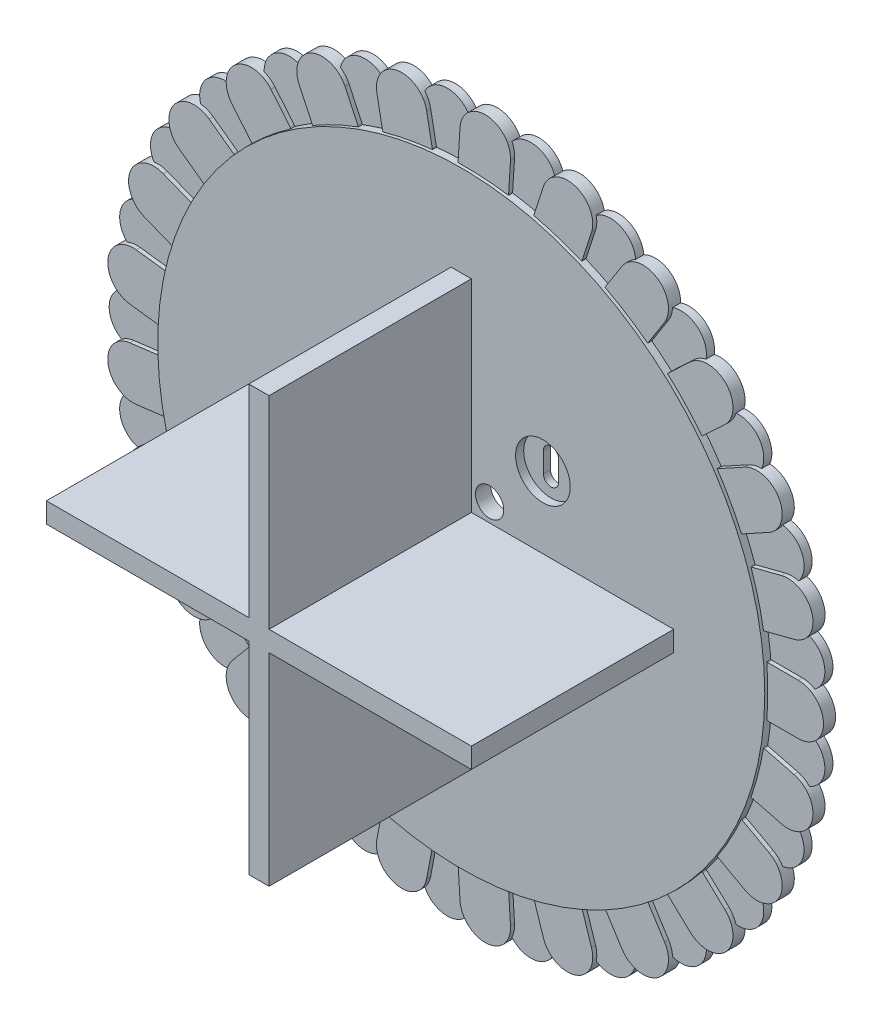
from build123d import *

# Parameters (mm, degrees)
SCHIZZO1_R                   = 30
ESTRUSIONE_ESTRUSIONE1_DEPTH = 1.5
ESTRUSIONE_ESTRUSIONE2_DEPTH = 20
ESTRUSIONE_ESTRUSIONE3_DEPTH = 0.8
ESTRUSIONE_ESTRUSIONE4_DEPTH = 1.2
SCHIZZO6_R                   = 1.4
TAGLIO_ESTRUSIONE3_DEPTH     = 54.998896887
SCHIZZO7_R                   = 2.7
TAGLIO_ESTRUSIONE4_DEPTH     = 0.8
TAGLIO_ESTRUSIONE5_DEPTH     = 54.998896887


with BuildPart() as part:
    # Schizzo1 → Estrusione-Estrusione1 (new body)
    with BuildSketch(Plane.XY):
        Circle(SCHIZZO1_R)
    extrude(amount=ESTRUSIONE_ESTRUSIONE1_DEPTH)

    # Schizzo2 → Estrusione-Estrusione2 (add)
    with BuildSketch(Plane.XY.offset(1.5)):
        Polygon((-1, 1), (-1, 21), (1, 21), (1, 1), (21, 1), (21, -1), (1, -1), (1, -21), (-1, -21), (-1, -1), (-21, -1), (-21, 1), align=None)
    extrude(amount=ESTRUSIONE_ESTRUSIONE2_DEPTH)

    # Schizzo5 → Estrusione-Estrusione3 (add)
    with BuildSketch(Plane(origin=(0, 0, 0), x_dir=(-1, 0, 0), z_dir=(0, 0, -1))):
        with BuildLine():
            ThreePointArc((-29.895833333, -2.497828918), (-29.947905355, -2.499457171), (-30, -2.5))
            Line((-30, -2.5), (-33, -2.5))
            ThreePointArc((-33, -2.5), (-33.655910107, -2.41242242), (-34.265865799, -2.155825545))
            ThreePointArc((-34.265865799, -2.155825545), (-35.220071897, -4.449329792), (-33.725472626, -6.433477978))
            ThreePointArc((-33.725472626, -6.433477978), (-33.198492862, -6.033252754), (-32.584969035, -5.785308374))
            Line((-32.584969035, -5.785308374), (-29.679219552, -5.039238712))
            ThreePointArc((-29.679219552, -5.039238712), (-29.62862656, -5.026809076), (-29.577785546, -5.015436389))
            ThreePointArc((-29.577785546, -5.015436389), (-29.763441039, -3.759997007), (-29.895833333, -2.497828918))
        make_face()
        with BuildLine():
            ThreePointArc((-33.725472626, 6.433477978), (-35.220071897, 4.449329792), (-34.265865799, 2.155825545))
            ThreePointArc((-34.265865799, 2.155825545), (-33.655910107, 2.41242242), (-33, 2.5))
            Line((-33, 2.5), (-30, 2.5))
            ThreePointArc((-30, 2.5), (-29.947905355, 2.499457171), (-29.895833333, 2.497828918))
            ThreePointArc((-29.895833333, 2.497828918), (-29.763441039, 3.759997007), (-29.577785546, 5.015436389))
            ThreePointArc((-29.577785546, 5.015436389), (-29.62862656, 5.026809076), (-29.679219552, 5.039238712))
            Line((-29.679219552, 5.039238712), (-32.584969035, 5.785308374))
            ThreePointArc((-32.584969035, 5.785308374), (-33.198492862, 6.033252754), (-33.725472626, 6.433477978))
        make_face()
        with BuildLine():
            ThreePointArc((-31.341519599, -10.628224179), (-31.998602743, -10.70651622), (-32.653208603, -10.60967062))
            ThreePointArc((-32.653208603, -10.60967062), (-33.007065249, -13.06842162), (-31.065983974, -14.618542419))
            ThreePointArc((-31.065983974, -14.618542419), (-30.655092214, -14.099836468), (-30.122504627, -13.707104545))
            Line((-30.122504627, -13.707104545), (-27.493584587, -12.261843523))
            ThreePointArc((-27.493584587, -12.261843523), (-27.447672191, -12.237222421), (-27.401256714, -12.213563382))
            ThreePointArc((-27.401256714, -12.213563382), (-27.893294577, -11.043736581), (-28.335415963, -9.854146448))
            ThreePointArc((-28.335415963, -9.854146448), (-28.385447116, -9.868673331), (-28.435770116, -9.882154518))
            Line((-28.435770116, -9.882154518), (-31.341519599, -10.628224179))
        make_face()
        with BuildLine():
            ThreePointArc((-31.065983974, 14.618542419), (-33.007065249, 13.06842162), (-32.653208603, 10.60967062))
            ThreePointArc((-32.653208603, 10.60967062), (-31.998602743, 10.70651622), (-31.341519599, 10.628224179))
            Line((-31.341519599, 10.628224179), (-28.435770116, 9.882154518))
            ThreePointArc((-28.435770116, 9.882154518), (-28.385447116, 9.868673331), (-28.335415963, 9.854146448))
            ThreePointArc((-28.335415963, 9.854146448), (-27.893294577, 11.043736581), (-27.401256714, 12.213563382))
            ThreePointArc((-27.401256714, 12.213563382), (-27.447672191, 12.237222421), (-27.493584587, 12.261843523))
            Line((-27.493584587, 12.261843523), (-30.122504627, 13.707104545))
            ThreePointArc((-30.122504627, 13.707104545), (-30.655092214, 14.099836468), (-31.065983974, 14.618542419))
        make_face()
        with BuildLine():
            ThreePointArc((-27.713736256, -18.088637945), (-28.330705486, -18.327880231), (-28.98883022, -18.396871071))
            ThreePointArc((-28.98883022, -18.396871071), (-28.7201033, -20.866376456), (-26.454505296, -21.885070076))
            ThreePointArc((-26.454505296, -21.885070076), (-26.185519381, -21.280475601), (-25.76733247, -20.767632927))
            Line((-25.76733247, -20.767632927), (-23.580426587, -18.713991609))
            ThreePointArc((-23.580426587, -18.713991609), (-23.542079634, -18.678726077), (-23.503006148, -18.644267269))
            ThreePointArc((-23.503006148, -18.644267269), (-24.270509831, -17.633557569), (-24.994580197, -16.591291715))
            ThreePointArc((-24.994580197, -16.591291715), (-25.039426841, -16.617804452), (-25.084816216, -16.643376923))
            Line((-25.084816216, -16.643376923), (-27.713736256, -18.088637945))
        make_face()
        with BuildLine():
            ThreePointArc((-26.454505296, 21.885070076), (-28.7201033, 20.866376456), (-28.98883022, 18.396871071))
            ThreePointArc((-28.98883022, 18.396871071), (-28.330705486, 18.327880231), (-27.713736256, 18.088637945))
            Line((-27.713736256, 18.088637945), (-25.084816216, 16.643376923))
            ThreePointArc((-25.084816216, 16.643376923), (-25.039426841, 16.617804452), (-24.994580197, 16.591291715))
            ThreePointArc((-24.994580197, 16.591291715), (-24.270509831, 17.633557569), (-23.503006148, 18.644267269))
            ThreePointArc((-23.503006148, 18.644267269), (-23.542079634, 18.678726077), (-23.580426587, 18.713991609))
            Line((-23.580426587, 18.713991609), (-25.76733247, 20.767632927))
            ThreePointArc((-25.76733247, 20.767632927), (-26.185519381, 21.280475601), (-26.454505296, 21.885070076))
        make_face()
        with BuildLine():
            ThreePointArc((-22.34459694, -24.412476064), (-22.88268581, -24.797636121), (-23.502977021, -25.028128453))
            ThreePointArc((-23.502977021, -25.028128453), (-22.628551636, -27.353220119), (-20.180792758, -27.776478293))
            ThreePointArc((-20.180792758, -27.776478293), (-20.070614062, -27.123984189), (-19.793104048, -26.523254554))
            Line((-19.793104048, -26.523254554), (-18.185623663, -23.990270778))
            ThreePointArc((-18.185623663, -23.990270778), (-18.157251631, -23.946576677), (-18.127975267, -23.903483276))
            ThreePointArc((-18.127975267, -23.903483276), (-19.122719692, -23.115397283), (-20.083243033, -22.285945106))
            ThreePointArc((-20.083243033, -22.285945106), (-20.120087288, -22.322777803), (-20.157691058, -22.358834746))
            Line((-20.157691058, -22.358834746), (-22.34459694, -24.412476064))
        make_face()
        with BuildLine():
            ThreePointArc((-20.180792758, 27.776478293), (-22.628551636, 27.353220119), (-23.502977021, 25.028128453))
            ThreePointArc((-23.502977021, 25.028128453), (-22.88268581, 24.797636121), (-22.34459694, 24.412476064))
            Line((-22.34459694, 24.412476064), (-20.157691058, 22.358834746))
            ThreePointArc((-20.157691058, 22.358834746), (-20.120087288, 22.322777803), (-20.083243033, 22.285945106))
            ThreePointArc((-20.083243033, 22.285945106), (-19.122719692, 23.115397283), (-18.127975267, 23.903483276))
            ThreePointArc((-18.127975267, 23.903483276), (-18.157251631, 23.946576677), (-18.185623663, 23.990270778))
            Line((-18.185623663, 23.990270778), (-19.793104048, 26.523254554))
            ThreePointArc((-19.793104048, 26.523254554), (-20.070614062, 27.123984189), (-20.180792758, 27.776478293))
        make_face()
        with BuildLine():
            ThreePointArc((-15.571464421, -29.202388529), (-15.996862828, -29.709265335), (-16.540345338, -30.086776478))
            ThreePointArc((-16.540345338, -30.086776478), (-15.115164851, -32.121360363), (-12.639046791, -31.922588224))
            ThreePointArc((-12.639046791, -31.922588224), (-12.694598247, -31.263193094), (-12.575202105, -30.612322552))
            Line((-12.575202105, -30.612322552), (-11.648151122, -27.759153003))
            ThreePointArc((-11.648151122, -27.759153003), (-11.63153673, -27.709775795), (-11.61389703, -27.660755517))
            ThreePointArc((-11.61389703, -27.660755517), (-12.773378747, -27.144811574), (-13.910001849, -26.580290603))
            ThreePointArc((-13.910001849, -26.580290603), (-13.936528655, -26.625128927), (-13.963984036, -26.669404753))
            Line((-13.963984036, -26.669404753), (-15.571464421, -29.202388529))
        make_face()
        with BuildLine():
            ThreePointArc((-12.639046791, 31.922588224), (-15.115164851, 32.121360363), (-16.540345338, 30.086776478))
            ThreePointArc((-16.540345338, 30.086776478), (-15.996862828, 29.709265335), (-15.571464421, 29.202388529))
            Line((-15.571464421, 29.202388529), (-13.963984036, 26.669404753))
            ThreePointArc((-13.963984036, 26.669404753), (-13.936528655, 26.625128927), (-13.910001849, 26.580290603))
            ThreePointArc((-13.910001849, 26.580290603), (-12.773378747, 27.144811574), (-11.61389703, 27.660755517))
            ThreePointArc((-11.61389703, 27.660755517), (-11.63153673, 27.709775795), (-11.648151122, 27.759153003))
            Line((-11.648151122, 27.759153003), (-12.575202105, 30.612322552))
            ThreePointArc((-12.575202105, 30.612322552), (-12.694598247, 31.263193094), (-12.639046791, 31.922588224))
        make_face()
        with BuildLine():
            ThreePointArc((-7.819919524, -32.157407524), (-8.105898122, -32.754152145), (-8.538422926, -33.254961685))
            ThreePointArc((-8.538422926, -33.254961685), (-6.652036668, -34.871197401), (-4.303143031, -34.062884534))
            ThreePointArc((-4.303143031, -34.062884534), (-4.520934136, -33.4380206), (-4.567153966, -32.777905739))
            Line((-4.567153966, -32.777905739), (-4.378782407, -29.783825554))
            ThreePointArc((-4.378782407, -29.783825554), (-4.374969599, -29.731867791), (-4.37007493, -29.68000076))
            ThreePointArc((-4.37007493, -29.68000076), (-5.621439438, -29.468617522), (-6.862744092, -29.204498687))
            ThreePointArc((-6.862744092, -29.204498687), (-6.877286671, -29.25452528), (-6.892868541, -29.304237975))
            Line((-6.892868541, -29.304237975), (-7.819919524, -32.157407524))
        make_face()
        with BuildLine():
            ThreePointArc((-4.303143031, 34.062884534), (-6.652036668, 34.871197401), (-8.538422926, 33.254961685))
            ThreePointArc((-8.538422926, 33.254961685), (-8.105898122, 32.754152145), (-7.819919524, 32.157407524))
            Line((-7.819919524, 32.157407524), (-6.892868541, 29.304237975))
            ThreePointArc((-6.892868541, 29.304237975), (-6.877286671, 29.25452528), (-6.862744092, 29.204498687))
            ThreePointArc((-6.862744092, 29.204498687), (-5.621439438, 29.468617522), (-4.37007493, 29.68000076))
            ThreePointArc((-4.37007493, 29.68000076), (-4.374969599, 29.731867791), (-4.378782407, 29.783825554))
            Line((-4.378782407, 29.783825554), (-4.567153966, 32.777905739))
            ThreePointArc((-4.567153966, 32.777905739), (-4.520934136, 33.4380206), (-4.303143031, 34.062884534))
        make_face()
        with BuildLine():
            ThreePointArc((0.422979677, -33.091858337), (0.294389974, -33.740975114), (0, -34.333615346))
            ThreePointArc((0, -34.333615346), (2.229063443, -35.429948859), (4.303143031, -34.062884534))
            ThreePointArc((4.303143031, -34.062884534), (3.936796893, -33.511814294), (3.727865255, -32.883932561))
            Line((3.727865255, -32.883932561), (3.165721311, -29.937070808))
            ThreePointArc((3.165721311, -29.937070808), (3.156492962, -29.885797187), (3.14833505, -29.8343424))
            ThreePointArc((3.14833505, -29.8343424), (1.883715586, -29.940801853), (0.615725117, -29.993680711))
            ThreePointArc((0.615725117, -29.993680711), (0.614080527, -30.045752219), (0.611351235, -30.097778152))
            Line((0.611351235, -30.097778152), (0.422979677, -33.091858337))
        make_face()
        with BuildLine():
            ThreePointArc((4.303143031, 34.062884534), (2.229063443, 35.429948859), (0, 34.333615346))
            ThreePointArc((0, 34.333615346), (0.294389974, 33.740975114), (0.422979677, 33.091858337))
            Line((0.422979677, 33.091858337), (0.611351235, 30.097778152))
            ThreePointArc((0.611351235, 30.097778152), (0.614080527, 30.045752219), (0.615725117, 29.993680711))
            ThreePointArc((0.615725117, 29.993680711), (1.883715586, 29.940801853), (3.14833505, 29.8343424))
            ThreePointArc((3.14833505, 29.8343424), (3.156492962, 29.885797187), (3.165721311, 29.937070808))
            Line((3.165721311, 29.937070808), (3.727865255, 32.883932561))
            ThreePointArc((3.727865255, 32.883932561), (3.936796893, 33.511814294), (4.303143031, 34.062884534))
        make_face()
        with BuildLine():
            ThreePointArc((8.639301508, -31.947025988), (8.676180466, -32.607728526), (8.538422926, -33.254961685))
            ThreePointArc((8.538422926, -33.254961685), (10.9701033, -33.762506328), (12.639046791, -31.922588224))
            ThreePointArc((12.639046791, -31.922588224), (12.147164495, -31.479937449), (11.78864899, -30.92374096))
            Line((11.78864899, -30.92374096), (10.511311116, -28.209259803))
            ThreePointArc((10.511311116, -28.209259803), (10.489621462, -28.161892034), (10.46892356, -28.114082583))
            ThreePointArc((10.46892356, -28.114082583), (9.270509831, -28.531695489), (8.055506052, -28.898249467))
            ThreePointArc((8.055506052, -28.898249467), (8.066862787, -28.949094046), (8.077157564, -29.000164235))
            Line((8.077157564, -29.000164235), (8.639301508, -31.947025988))
        make_face()
        with BuildLine():
            ThreePointArc((12.639046791, 31.922588224), (10.9701033, 33.762506328), (8.538422926, 33.254961685))
            ThreePointArc((8.538422926, 33.254961685), (8.676180466, 32.607728526), (8.639301508, 31.947025988))
            Line((8.639301508, 31.947025988), (8.077157564, 29.000164235))
            ThreePointArc((8.077157564, 29.000164235), (8.066862787, 28.949094046), (8.055506052, 28.898249467))
            ThreePointArc((8.055506052, 28.898249467), (9.270509831, 28.531695489), (10.46892356, 28.114082583))
            ThreePointArc((10.46892356, 28.114082583), (10.489621462, 28.161892034), (10.511311116, 28.209259803))
            Line((10.511311116, 28.209259803), (11.78864899, 30.92374096))
            ThreePointArc((11.78864899, 30.92374096), (12.147164495, 31.479937449), (12.639046791, 31.922588224))
        make_face()
        with BuildLine():
            ThreePointArc((16.312784253, -28.794844502), (16.51281463, -29.425618432), (16.540345338, -30.086776478))
            ThreePointArc((16.540345338, -30.086776478), (19.021851222, -29.973641355), (20.180792758, -27.776478293))
            ThreePointArc((20.180792758, -27.776478293), (19.594281078, -27.470060359), (19.108708555, -27.020496986))
            Line((19.108708555, -27.020496986), (17.196436586, -24.708957258))
            ThreePointArc((17.196436586, -24.708957258), (17.163648466, -24.668471632), (17.1317111, -24.627311562))
            ThreePointArc((17.1317111, -24.627311562), (16.074803849, -25.329837765), (14.989129915, -25.987034929))
            ThreePointArc((14.989129915, -25.987034929), (15.012774391, -26.033457827), (15.035446378, -26.080363345))
            Line((15.035446378, -26.080363345), (16.312784253, -28.794844502))
        make_face()
        with BuildLine():
            ThreePointArc((20.180792758, 27.776478293), (19.021851222, 29.973641355), (16.540345338, 30.086776478))
            ThreePointArc((16.540345338, 30.086776478), (16.51281463, 29.425618432), (16.312784253, 28.794844502))
            Line((16.312784253, 28.794844502), (15.035446378, 26.080363345))
            ThreePointArc((15.035446378, 26.080363345), (15.012774391, 26.033457827), (14.989129915, 25.987034929))
            ThreePointArc((14.989129915, 25.987034929), (16.074803849, 25.329837765), (17.1317111, 24.627311562))
            ThreePointArc((17.1317111, 24.627311562), (17.163648466, 24.668471632), (17.196436586, 24.708957258))
            Line((17.196436586, 24.708957258), (19.108708555, 27.020496986))
            ThreePointArc((19.108708555, 27.020496986), (19.594281078, 27.470060359), (20.180792758, 27.776478293))
        make_face()
        with BuildLine():
            ThreePointArc((22.961274769, -23.833377037), (23.311887921, -24.394588512), (23.502977021, -25.028128453))
            ThreePointArc((23.502977021, -25.028128453), (25.878386273, -24.30142226), (26.454505296, -21.885070076))
            ThreePointArc((26.454505296, -21.885070076), (25.810216917, -21.734138349), (25.228097684, -21.419455812))
            Line((25.228097684, -21.419455812), (22.801046701, -19.656100055))
            ThreePointArc((22.801046701, -19.656100055), (22.759220315, -19.625040433), (22.718050227, -19.593115982))
            ThreePointArc((22.718050227, -19.593115982), (21.869058823, -20.536413178), (20.98093162, -21.442959412))
            ThreePointArc((20.98093162, -21.442959412), (21.015378166, -21.482043708), (21.049002799, -21.521837309))
            Line((21.049002799, -21.521837309), (22.961274769, -23.833377037))
        make_face()
        with BuildLine():
            ThreePointArc((26.454505296, 21.885070076), (25.878386273, 24.30142226), (23.502977021, 25.028128453))
            ThreePointArc((23.502977021, 25.028128453), (23.311887921, 24.394588512), (22.961274769, 23.833377037))
            Line((22.961274769, 23.833377037), (21.049002799, 21.521837309))
            ThreePointArc((21.049002799, 21.521837309), (21.015378166, 21.482043708), (20.98093162, 21.442959412))
            ThreePointArc((20.98093162, 21.442959412), (21.869058823, 20.536413178), (22.718050227, 19.593115982))
            ThreePointArc((22.718050227, 19.593115982), (22.759220315, 19.625040433), (22.801046701, 19.656100055))
            Line((22.801046701, 19.656100055), (25.228097684, 21.419455812))
            ThreePointArc((25.228097684, 21.419455812), (25.810216917, 21.734138349), (26.454505296, 21.885070076))
        make_face()
        with BuildLine():
            ThreePointArc((28.167023945, -17.37437084), (28.646189559, -17.830756878), (28.98883022, -18.396871071))
            ThreePointArc((28.98883022, -18.396871071), (31.108887142, -17.102255431), (31.065983974, -14.618542419))
            ThreePointArc((31.065983974, -14.618542419), (30.404401905, -14.632580493), (29.762312653, -14.472551453))
            Line((29.762312653, -14.472551453), (26.972983195, -13.368177795))
            ThreePointArc((26.972983195, -13.368177795), (26.924746648, -13.348495768), (26.876930706, -13.327812867))
            ThreePointArc((26.876930706, -13.327812867), (26.289200401, -14.452610223), (25.654424229, -15.551543894))
            ThreePointArc((25.654424229, -15.551543894), (25.697508442, -15.580833777), (25.739972962, -15.611015083))
            Line((25.739972962, -15.611015083), (28.167023945, -17.37437084))
        make_face()
        with BuildLine():
            ThreePointArc((31.065983974, 14.618542419), (31.108887142, 17.102255431), (28.98883022, 18.396871071))
            ThreePointArc((28.98883022, 18.396871071), (28.646189559, 17.830756878), (28.167023945, 17.37437084))
            Line((28.167023945, 17.37437084), (25.739972962, 15.611015083))
            ThreePointArc((25.739972962, 15.611015083), (25.697508442, 15.580833777), (25.654424229, 15.551543894))
            ThreePointArc((25.654424229, 15.551543894), (26.289200401, 14.452610223), (26.876930706, 13.327812867))
            ThreePointArc((26.876930706, 13.327812867), (26.924746648, 13.348495768), (26.972983195, 13.368177795))
            Line((26.972983195, 13.368177795), (29.762312653, 14.472551453))
            ThreePointArc((29.762312653, 14.472551453), (30.404401905, 14.632580493), (31.065983974, 14.618542419))
        make_face()
        with BuildLine():
            ThreePointArc((31.602935416, -9.823669024), (32.180545753, -10.146553214), (32.653208603, -10.60967062))
            ThreePointArc((32.653208603, -10.60967062), (34.38470222, -8.828490994), (33.725472626, -6.433477978))
            ThreePointArc((33.725472626, -6.433477978), (33.088166501, -6.611603791), (32.426452059, -6.616283461))
            Line((32.426452059, -6.616283461), (29.450107956, -6.24028376))
            ThreePointArc((29.450107956, -6.24028376), (29.398492127, -6.233216021), (29.347034783, -6.225074253))
            ThreePointArc((29.347034783, -6.225074253), (29.057494834, -7.460696615), (28.715955013, -8.682967679))
            ThreePointArc((28.715955013, -8.682967679), (28.764969754, -8.700622758), (28.813605958, -8.719295366))
            Line((28.813605958, -8.719295366), (31.602935416, -9.823669024))
        make_face()
        with BuildLine():
            ThreePointArc((33.725472626, 6.433477978), (34.38470222, 8.828490994), (32.653208603, 10.60967062))
            ThreePointArc((32.653208603, 10.60967062), (32.180545753, 10.146553214), (31.602935416, 9.823669024))
            Line((31.602935416, 9.823669024), (28.813605958, 8.719295366))
            ThreePointArc((28.813605958, 8.719295366), (28.764969754, 8.700622758), (28.715955013, 8.682967679))
            ThreePointArc((28.715955013, 8.682967679), (29.057494834, 7.460696615), (29.347034783, 6.225074253))
            ThreePointArc((29.347034783, 6.225074253), (29.398492127, 6.233216021), (29.450107956, 6.24028376))
            Line((29.450107956, 6.24028376), (32.426452059, 6.616283461))
            ThreePointArc((32.426452059, 6.616283461), (33.088166501, 6.611603791), (33.725472626, 6.433477978))
        make_face()
        with BuildLine():
            ThreePointArc((33.053118227, -1.655709954), (33.692879906, -1.824804294), (34.265865799, -2.155825545))
            ThreePointArc((34.265865799, -2.155825545), (35.5, 0), (34.265865799, 2.155825545))
            ThreePointArc((34.265865799, 2.155825545), (33.692879906, 1.824804294), (33.053118227, 1.655709954))
            Line((33.053118227, 1.655709954), (30.076774123, 1.279710254))
            ThreePointArc((30.076774123, 1.279710254), (30.025022226, 1.273719612), (29.973156733, 1.26880867))
            ThreePointArc((29.973156733, 1.26880867), (30, 0), (29.973156733, -1.26880867))
            ThreePointArc((29.973156733, -1.26880867), (30.025022226, -1.273719612), (30.076774123, -1.279710254))
            Line((30.076774123, -1.279710254), (33.053118227, -1.655709954))
        make_face()
    extrude(amount=-ESTRUSIONE_ESTRUSIONE3_DEPTH)

    # Schizzo5<3> → Estrusione-Estrusione4 (add)
    with BuildSketch(Plane(origin=(0, 0, 0), x_dir=(-1, 0, 0), z_dir=(0, 0, -1))):
        with BuildLine():
            Line((-30, -2.5), (-33, -2.5))
            ThreePointArc((-33, -2.5), (-35.5, 0), (-33, 2.5))
            Line((-33, 2.5), (-30, 2.5))
            ThreePointArc((-30, 2.5), (-27.5, 0), (-30, -2.5))
        make_face()
        with BuildLine():
            Line((-28.435770116, 9.882154518), (-31.341519599, 10.628224179))
            ThreePointArc((-31.341519599, 10.628224179), (-34.38470222, 8.828490994), (-32.584969035, 5.785308374))
            Line((-32.584969035, 5.785308374), (-29.679219552, 5.039238712))
            ThreePointArc((-29.679219552, 5.039238712), (-26.636036931, 6.838971897), (-28.435770116, 9.882154518))
        make_face()
        with BuildLine():
            Line((-25.084816216, 16.643376923), (-27.713736256, 18.088637945))
            ThreePointArc((-27.713736256, 18.088637945), (-31.108887142, 17.102255431), (-30.122504627, 13.707104545))
            Line((-30.122504627, 13.707104545), (-27.493584587, 12.261843523))
            ThreePointArc((-27.493584587, 12.261843523), (-24.098433701, 13.248226038), (-25.084816216, 16.643376923))
        make_face()
        with BuildLine():
            Line((-20.157691058, 22.358834746), (-22.34459694, 24.412476064))
            ThreePointArc((-22.34459694, 24.412476064), (-25.878386273, 24.30142226), (-25.76733247, 20.767632927))
            Line((-25.76733247, 20.767632927), (-23.580426587, 18.713991609))
            ThreePointArc((-23.580426587, 18.713991609), (-20.046637254, 18.825045413), (-20.157691058, 22.358834746))
        make_face()
        with BuildLine():
            Line((-13.963984036, 26.669404753), (-15.571464421, 29.202388529))
            ThreePointArc((-15.571464421, 29.202388529), (-19.021851222, 29.973641355), (-19.793104048, 26.523254554))
            Line((-19.793104048, 26.523254554), (-18.185623663, 23.990270778))
            ThreePointArc((-18.185623663, 23.990270778), (-14.735236862, 23.219017951), (-13.963984036, 26.669404753))
        make_face()
        with BuildLine():
            Line((-6.892868541, 29.304237975), (-7.819919524, 32.157407524))
            ThreePointArc((-7.819919524, 32.157407524), (-10.9701033, 33.762506328), (-12.575202105, 30.612322552))
            Line((-12.575202105, 30.612322552), (-11.648151122, 27.759153003))
            ThreePointArc((-11.648151122, 27.759153003), (-8.497967345, 26.154054198), (-6.892868541, 29.304237975))
        make_face()
        with BuildLine():
            Line((0.611351235, 30.097778152), (0.422979677, 33.091858337))
            ThreePointArc((0.422979677, 33.091858337), (-2.229063443, 35.429948859), (-4.567153966, 32.777905739))
            Line((-4.567153966, 32.777905739), (-4.378782407, 29.783825554))
            ThreePointArc((-4.378782407, 29.783825554), (-1.726739287, 27.445735032), (0.611351235, 30.097778152))
        make_face()
        with BuildLine():
            Line((8.077157564, 29.000164235), (8.639301508, 31.947025988))
            ThreePointArc((8.639301508, 31.947025988), (6.652036668, 34.871197401), (3.727865255, 32.883932561))
            Line((3.727865255, 32.883932561), (3.165721311, 29.937070808))
            ThreePointArc((3.165721311, 29.937070808), (5.152986151, 27.012899395), (8.077157564, 29.000164235))
        make_face()
        with BuildLine():
            Line((15.035446378, 26.080363345), (16.312784253, 28.794844502))
            ThreePointArc((16.312784253, 28.794844502), (15.115164851, 32.121360363), (11.78864899, 30.92374096))
            Line((11.78864899, 30.92374096), (10.511311116, 28.209259803))
            ThreePointArc((10.511311116, 28.209259803), (11.708930518, 24.882743943), (15.035446378, 26.080363345))
        make_face()
        with BuildLine():
            Line((21.049002799, 21.521837309), (22.961274769, 23.833377037))
            ThreePointArc((22.961274769, 23.833377037), (22.628551636, 27.353220119), (19.108708555, 27.020496986))
            Line((19.108708555, 27.020496986), (17.196436586, 24.708957258))
            ThreePointArc((17.196436586, 24.708957258), (17.529159718, 21.189114176), (21.049002799, 21.521837309))
        make_face()
        with BuildLine():
            Line((25.739972962, 15.611015083), (28.167023945, 17.37437084))
            ThreePointArc((28.167023945, 17.37437084), (28.7201033, 20.866376456), (25.228097684, 21.419455812))
            Line((25.228097684, 21.419455812), (22.801046701, 19.656100055))
            ThreePointArc((22.801046701, 19.656100055), (22.247967345, 16.164094438), (25.739972962, 15.611015083))
        make_face()
        with BuildLine():
            Line((28.813605958, 8.719295366), (31.602935416, 9.823669024))
            ThreePointArc((31.602935416, 9.823669024), (33.007065249, 13.06842162), (29.762312653, 14.472551453))
            Line((29.762312653, 14.472551453), (26.972983195, 13.368177795))
            ThreePointArc((26.972983195, 13.368177795), (25.568853362, 10.123425199), (28.813605958, 8.719295366))
        make_face()
        with BuildLine():
            Line((30.076774123, 1.279710254), (33.053118227, 1.655709954))
            ThreePointArc((33.053118227, 1.655709954), (35.220071897, 4.449329792), (32.426452059, 6.616283461))
            Line((32.426452059, 6.616283461), (29.450107956, 6.24028376))
            ThreePointArc((29.450107956, 6.24028376), (27.283154286, 3.446663923), (30.076774123, 1.279710254))
        make_face()
        with BuildLine():
            Line((29.450107956, -6.24028376), (32.426452059, -6.616283461))
            ThreePointArc((32.426452059, -6.616283461), (35.220071897, -4.449329792), (33.053118227, -1.655709954))
            Line((33.053118227, -1.655709954), (30.076774123, -1.279710254))
            ThreePointArc((30.076774123, -1.279710254), (27.283154286, -3.446663923), (29.450107956, -6.24028376))
        make_face()
        with BuildLine():
            Line((26.972983195, -13.368177795), (29.762312653, -14.472551453))
            ThreePointArc((29.762312653, -14.472551453), (33.007065249, -13.06842162), (31.602935416, -9.823669024))
            Line((31.602935416, -9.823669024), (28.813605958, -8.719295366))
            ThreePointArc((28.813605958, -8.719295366), (25.568853362, -10.123425199), (26.972983195, -13.368177795))
        make_face()
        with BuildLine():
            Line((22.801046701, -19.656100055), (25.228097684, -21.419455812))
            ThreePointArc((25.228097684, -21.419455812), (28.7201033, -20.866376456), (28.167023945, -17.37437084))
            Line((28.167023945, -17.37437084), (25.739972962, -15.611015083))
            ThreePointArc((25.739972962, -15.611015083), (22.247967345, -16.164094438), (22.801046701, -19.656100055))
        make_face()
        with BuildLine():
            Line((17.196436586, -24.708957258), (19.108708555, -27.020496986))
            ThreePointArc((19.108708555, -27.020496986), (22.628551636, -27.353220119), (22.961274769, -23.833377037))
            Line((22.961274769, -23.833377037), (21.049002799, -21.521837309))
            ThreePointArc((21.049002799, -21.521837309), (17.529159718, -21.189114176), (17.196436586, -24.708957258))
        make_face()
        with BuildLine():
            Line((10.511311116, -28.209259803), (11.78864899, -30.92374096))
            ThreePointArc((11.78864899, -30.92374096), (15.115164851, -32.121360363), (16.312784253, -28.794844502))
            Line((16.312784253, -28.794844502), (15.035446378, -26.080363345))
            ThreePointArc((15.035446378, -26.080363345), (11.708930518, -24.882743943), (10.511311116, -28.209259803))
        make_face()
        with BuildLine():
            Line((3.165721311, -29.937070808), (3.727865255, -32.883932561))
            ThreePointArc((3.727865255, -32.883932561), (6.652036668, -34.871197401), (8.639301508, -31.947025988))
            Line((8.639301508, -31.947025988), (8.077157564, -29.000164235))
            ThreePointArc((8.077157564, -29.000164235), (5.152986151, -27.012899395), (3.165721311, -29.937070808))
        make_face()
        with BuildLine():
            Line((-4.378782407, -29.783825554), (-4.567153966, -32.777905739))
            ThreePointArc((-4.567153966, -32.777905739), (-2.229063443, -35.429948859), (0.422979677, -33.091858337))
            Line((0.422979677, -33.091858337), (0.611351235, -30.097778152))
            ThreePointArc((0.611351235, -30.097778152), (-1.726739287, -27.445735032), (-4.378782407, -29.783825554))
        make_face()
        with BuildLine():
            Line((-11.648151122, -27.759153003), (-12.575202105, -30.612322552))
            ThreePointArc((-12.575202105, -30.612322552), (-10.9701033, -33.762506328), (-7.819919524, -32.157407524))
            Line((-7.819919524, -32.157407524), (-6.892868541, -29.304237975))
            ThreePointArc((-6.892868541, -29.304237975), (-8.497967345, -26.154054198), (-11.648151122, -27.759153003))
        make_face()
        with BuildLine():
            Line((-18.185623663, -23.990270778), (-19.793104048, -26.523254554))
            ThreePointArc((-19.793104048, -26.523254554), (-19.021851222, -29.973641355), (-15.571464421, -29.202388529))
            Line((-15.571464421, -29.202388529), (-13.963984036, -26.669404753))
            ThreePointArc((-13.963984036, -26.669404753), (-14.735236862, -23.219017951), (-18.185623663, -23.990270778))
        make_face()
        with BuildLine():
            Line((-23.580426587, -18.713991609), (-25.76733247, -20.767632927))
            ThreePointArc((-25.76733247, -20.767632927), (-25.878386273, -24.30142226), (-22.34459694, -24.412476064))
            Line((-22.34459694, -24.412476064), (-20.157691058, -22.358834746))
            ThreePointArc((-20.157691058, -22.358834746), (-20.046637254, -18.825045413), (-23.580426587, -18.713991609))
        make_face()
        with BuildLine():
            Line((-27.493584587, -12.261843523), (-30.122504627, -13.707104545))
            ThreePointArc((-30.122504627, -13.707104545), (-31.108887142, -17.102255431), (-27.713736256, -18.088637945))
            Line((-27.713736256, -18.088637945), (-25.084816216, -16.643376923))
            ThreePointArc((-25.084816216, -16.643376923), (-24.098433701, -13.248226038), (-27.493584587, -12.261843523))
        make_face()
        with BuildLine():
            Line((-29.679219552, -5.039238712), (-32.584969035, -5.785308374))
            ThreePointArc((-32.584969035, -5.785308374), (-34.38470222, -8.828490994), (-31.341519599, -10.628224179))
            Line((-31.341519599, -10.628224179), (-28.435770116, -9.882154518))
            ThreePointArc((-28.435770116, -9.882154518), (-26.636036931, -6.838971897), (-29.679219552, -5.039238712))
        make_face()
    extrude(amount=-ESTRUSIONE_ESTRUSIONE4_DEPTH)

    # Schizzo6 → Taglio-Estrusione3 (cut, through all)
    with BuildSketch(Plane.XY.offset(1.5)):
        with Locations((-2.8, 2.8)):
            Circle(SCHIZZO6_R)
        with Locations((-2.8, -2.8)):
            Circle(SCHIZZO6_R)
        with Locations((2.8, -2.8)):
            Circle(SCHIZZO6_R)
        with Locations((2.8, 2.8)):
            Circle(SCHIZZO6_R)
    extrude(amount=-TAGLIO_ESTRUSIONE3_DEPTH, mode=Mode.SUBTRACT)

    # Schizzo7 → Taglio-Estrusione4 (cut)
    with BuildSketch(Plane.XY.offset(1.5)):
        with Locations((-8.071067812, 8.071067812)):
            Circle(SCHIZZO7_R)
        with Locations((-8.071067812, -8.071067812)):
            Circle(SCHIZZO7_R)
        with Locations((8.071067812, -8.071067812)):
            Circle(SCHIZZO7_R)
        with Locations((8.071067812, 8.071067812)):
            Circle(SCHIZZO7_R)
    extrude(amount=-TAGLIO_ESTRUSIONE4_DEPTH, mode=Mode.SUBTRACT)

    # Schizzo3 → Taglio-Estrusione5 (cut, through all)
    with BuildSketch(Plane.XY.offset(1.5)):
        with BuildLine():
            Line((-7.321067812, 9.071067812), (-7.321067812, 7.071067812))
            ThreePointArc((-7.321067812, 7.071067812), (-8.071067812, 6.321067812), (-8.821067812, 7.071067812))
            Line((-8.821067812, 7.071067812), (-8.821067812, 9.071067812))
            ThreePointArc((-8.821067812, 9.071067812), (-8.071067812, 9.821067812), (-7.321067812, 9.071067812))
        make_face()
        with BuildLine():
            Line((-7.321067812, -9.071067812), (-7.321067812, -7.071067812))
            ThreePointArc((-7.321067812, -7.071067812), (-8.071067812, -6.321067812), (-8.821067812, -7.071067812))
            Line((-8.821067812, -7.071067812), (-8.821067812, -9.071067812))
            ThreePointArc((-8.821067812, -9.071067812), (-8.071067812, -9.821067812), (-7.321067812, -9.071067812))
        make_face()
        with BuildLine():
            Line((7.321067812, -9.071067812), (7.321067812, -7.071067812))
            ThreePointArc((7.321067812, -7.071067812), (8.071067812, -6.321067812), (8.821067812, -7.071067812))
            Line((8.821067812, -7.071067812), (8.821067812, -9.071067812))
            ThreePointArc((8.821067812, -9.071067812), (8.071067812, -9.821067812), (7.321067812, -9.071067812))
        make_face()
        with BuildLine():
            Line((7.321067812, 9.071067812), (7.321067812, 7.071067812))
            ThreePointArc((7.321067812, 7.071067812), (8.071067812, 6.321067812), (8.821067812, 7.071067812))
            Line((8.821067812, 7.071067812), (8.821067812, 9.071067812))
            ThreePointArc((8.821067812, 9.071067812), (8.071067812, 9.821067812), (7.321067812, 9.071067812))
        make_face()
    extrude(amount=-TAGLIO_ESTRUSIONE5_DEPTH, mode=Mode.SUBTRACT)


solid = part.part
